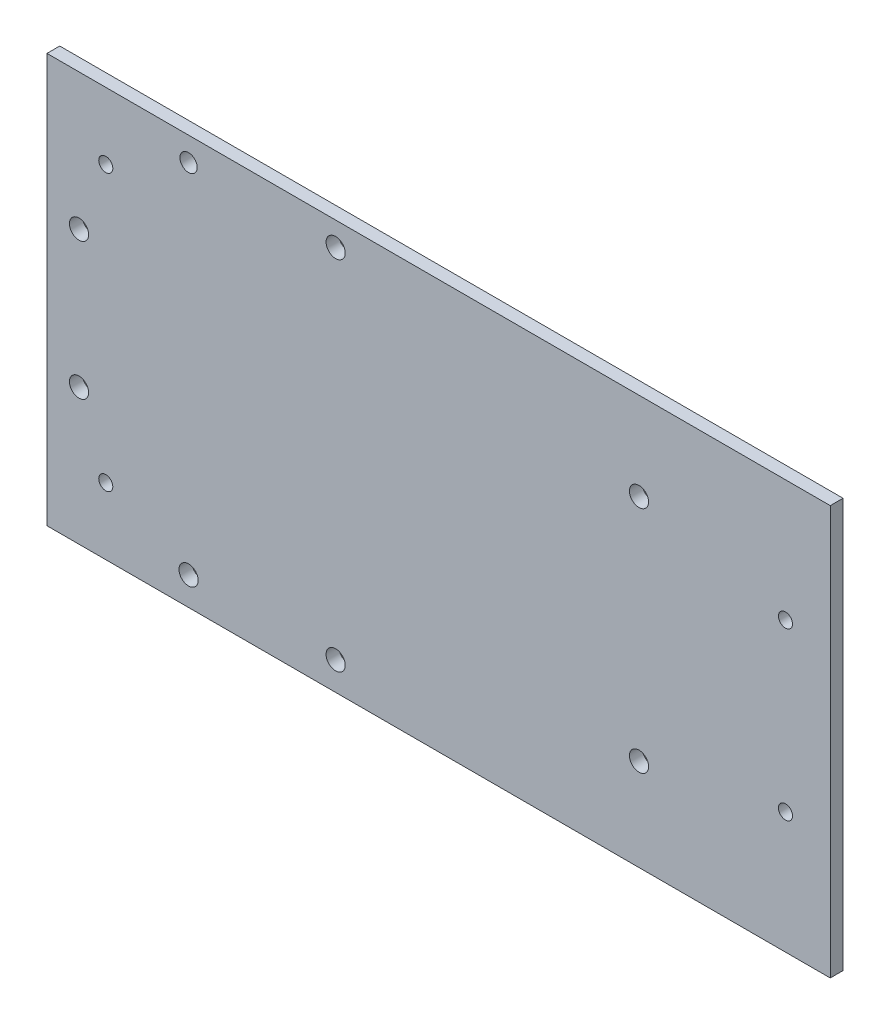
from build123d import *

# Parameters (mm, degrees)
SKETCH3_W           = 306.35
SKETCH3_H           = 160
BOSS_EXTRUDE1_DEPTH = 5
SKETCH4_R           = 3.75
SKETCH4_R_2         = 3.37238591
CUT_EXTRUDE1_DEPTH  = 204.048423739
SKETCH5_R           = 2.75
CUT_EXTRUDE2_DEPTH  = 204.048423739


with BuildPart() as part:
    # Sketch3 → Boss-Extrude1 (new body)
    with BuildSketch(Plane.XY):
        with Locations((0, 53.195652174)):
            Rectangle(SKETCH3_W, SKETCH3_H)
    extrude(amount=BOSS_EXTRUDE1_DEPTH)

    # Sketch4 → Cut-Extrude1 (cut, through all)
    with BuildSketch(Plane(origin=(0, 0, 0), x_dir=(-1, 0, 0), z_dir=(0, 0, -1))):
        with Locations((140.6297, 26.444452174)):
            Circle(SKETCH4_R)
        with Locations((140.6297, 79.946852174)):
            Circle(SKETCH4_R)
        with Locations((97.795, -15.754347826)):
            Circle(SKETCH4_R)
        with Locations((40.265, -15.754347826)):
            Circle(SKETCH4_R)
        with Locations((97.795, 123.895652174)):
            Circle(SKETCH4_R_2)
        with Locations((40.265, 123.895652174)):
            Circle(SKETCH4_R)
        with Locations((-78.375, 9.245652174)):
            Circle(SKETCH4_R)
        with Locations((-78.375, 98.895652174)):
            Circle(SKETCH4_R)
    extrude(amount=-CUT_EXTRUDE1_DEPTH, mode=Mode.SUBTRACT)

    # Sketch5 → Cut-Extrude2 (cut, through all)
    with BuildSketch(Plane(origin=(0, 0, 0), x_dir=(-1, 0, 0), z_dir=(0, 0, -1))):
        with Locations((-135.665, 20.695652174)):
            Circle(SKETCH5_R)
        with Locations((-135.665, 85.695652174)):
            Circle(SKETCH5_R)
        with Locations((130.175, 107.095652174)):
            Circle(SKETCH5_R)
        with Locations((130.175, -0.704347826)):
            Circle(SKETCH5_R)
    extrude(amount=-CUT_EXTRUDE2_DEPTH, mode=Mode.SUBTRACT)


solid = part.part
